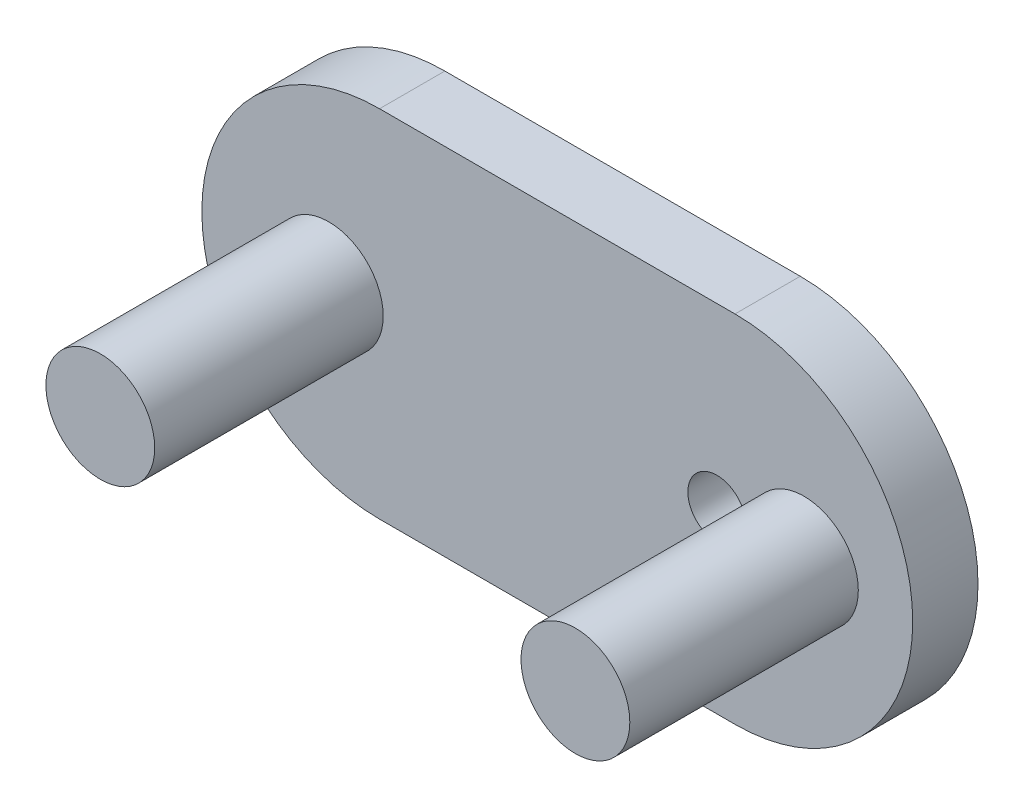
from build123d import *

# Parameters (mm, degrees)
SCHIZZO1_R                   = 0.8
ESTRUSIONE_ESTRUSIONE1_DEPTH = 1.8
SCHIZZO2_R                   = 1.5
ESTRUSIONE_ESTRUSIONE2_DEPTH = 6.3
SCHIZZO3_R                   = 1.5
ESTRUSIONE_ESTRUSIONE3_DEPTH = 6.3


with BuildPart() as part:
    # Schizzo1 → Estrusione-Estrusione1 (new body)
    with BuildSketch(Plane.XY):
        with BuildLine():
            Line((-4.9, 4.9), (4.9, 4.9))
            ThreePointArc((4.9, 4.9), (9.8, 0), (4.9, -4.9))
            Line((4.9, -4.9), (-4.9, -4.9))
            ThreePointArc((-4.9, -4.9), (-9.8, 0), (-4.9, 4.9))
        make_face()
        with Locations((4.4, 0)):
            Circle(SCHIZZO1_R, mode=Mode.SUBTRACT)
    extrude(amount=ESTRUSIONE_ESTRUSIONE1_DEPTH)

    # Schizzo2 → Estrusione-Estrusione2 (add)
    with BuildSketch(Plane.XY.offset(1.8)):
        with Locations((-6.3, 0)):
            Circle(SCHIZZO2_R)
    extrude(amount=ESTRUSIONE_ESTRUSIONE2_DEPTH)

    # Schizzo3 → Estrusione-Estrusione3 (add)
    with BuildSketch(Plane.XY.offset(1.8)):
        with Locations((6.8, 0)):
            Circle(SCHIZZO3_R)
    extrude(amount=ESTRUSIONE_ESTRUSIONE3_DEPTH)


solid = part.part
